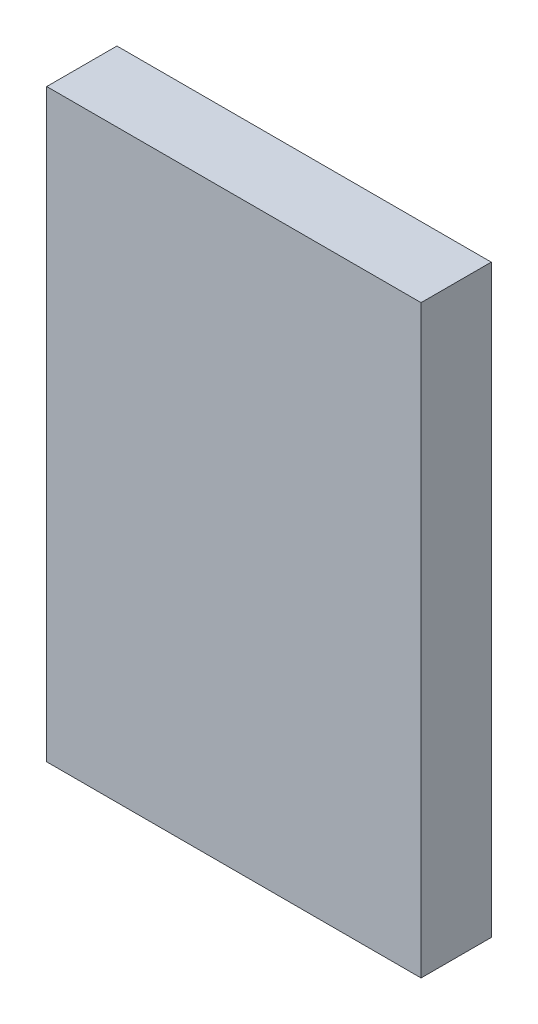
from build123d import *

# Parameters (mm, degrees)
BOSS_EXTRUDE1_DEPTH = 5.715


with BuildPart() as part:
    # Sketch1 → Boss-Extrude1 (new body)
    with BuildSketch(Plane.XY):
        Polygon((15.24, -23.8125), (15.24, 20.193), (15.24, 23.8125), (-15.24, 23.8125), (-15.24, -23.8125), align=None)
    extrude(amount=BOSS_EXTRUDE1_DEPTH)


solid = part.part
